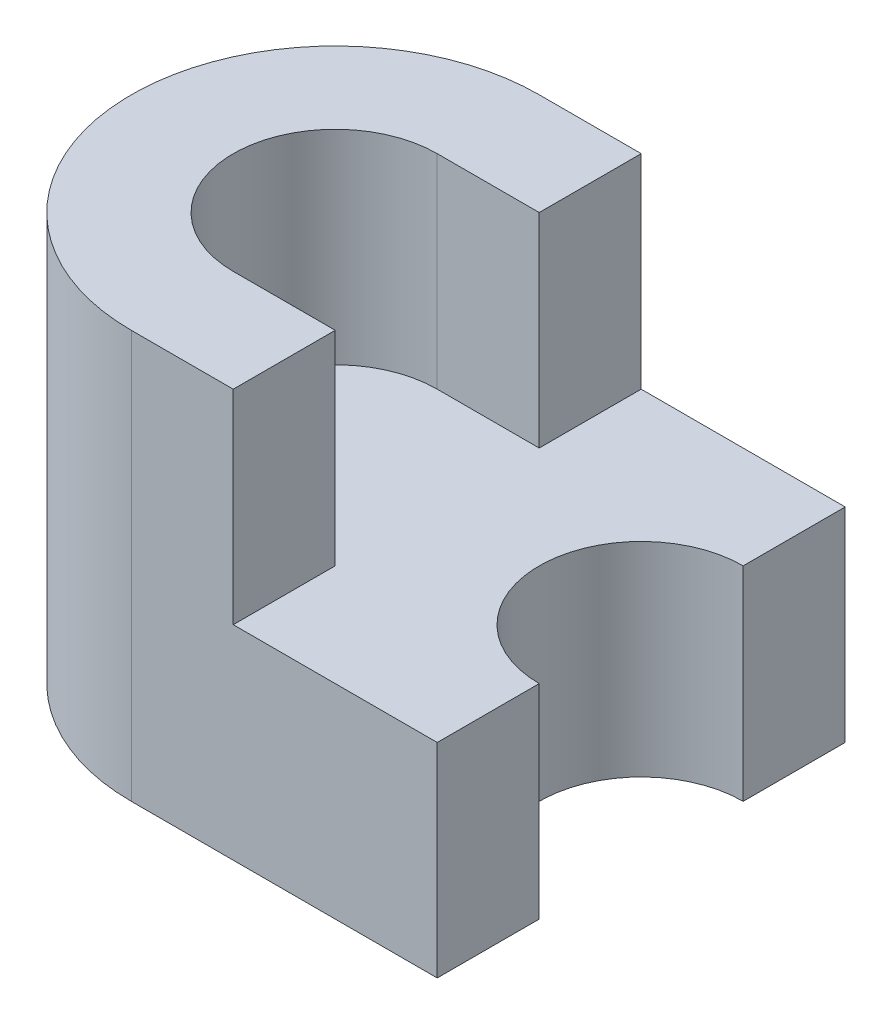
from build123d import *

# Parameters (mm, degrees)
EXTRUDE_1_DEPTH = 10
EXTRUDE_2_DEPTH = 10


with BuildPart() as part:
    # 草圖2 → 填料-伸長1 (new body)
    with BuildSketch(Plane(origin=(0, 0, 0), x_dir=(1, 0, 0), z_dir=(0, 1, 0))):
        with BuildLine():
            Line((0, 5), (0, 10))
            Line((0, 10), (-15, 10))
            ThreePointArc((-15, 10), (-25, 0), (-15, -10))
            Line((-15, -10), (0, -10))
            Line((0, -10), (0, -5))
            ThreePointArc((0, -5), (-5, 0), (0, 5))
        make_face()
    extrude(amount=EXTRUDE_1_DEPTH)

    # 草圖3 → 填料-伸長2 (add)
    with BuildSketch(Plane(origin=(0, 10, 0), x_dir=(1, 0, 0), z_dir=(0, 1, 0))):
        with BuildLine():
            Line((-10, 5), (-10, 10))
            Line((-10, 10), (-15, 10))
            ThreePointArc((-15, 10), (-25, 0), (-15, -10))
            Line((-15, -10), (-10, -10))
            Line((-10, -10), (-10, -5))
            Line((-10, -5), (-15, -5))
            ThreePointArc((-15, -5), (-20, 0), (-15, 5))
            Line((-15, 5), (-10, 5))
        make_face()
    extrude(amount=EXTRUDE_2_DEPTH)


solid = part.part
